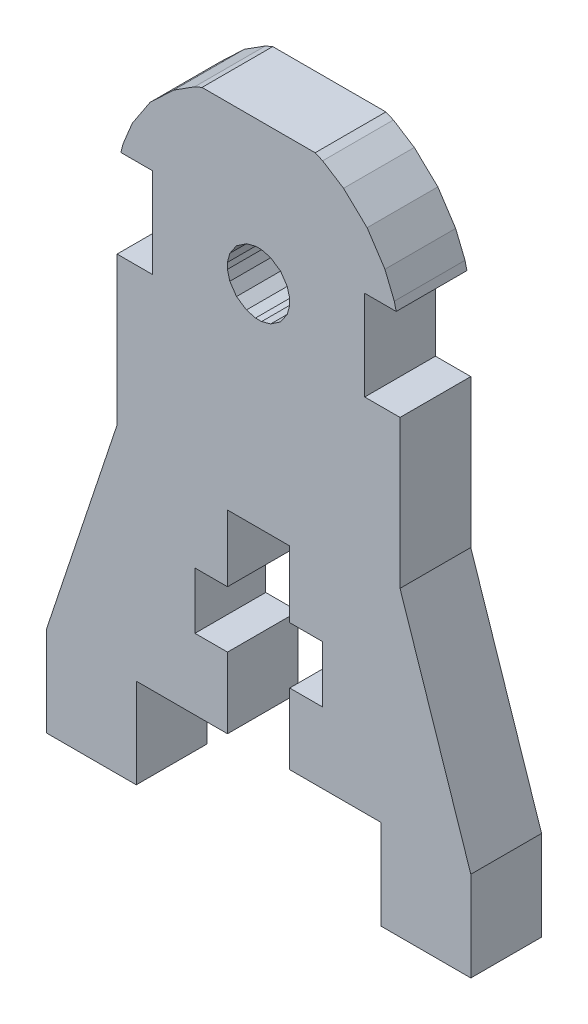
from build123d import *

# Parameters (mm, degrees)
BOSS_EXTRUDE1_DEPTH = 5


with BuildPart() as part:
    # Sketch1 → Boss-Extrude1 (new body)
    with BuildSketch(Plane.XY):
        Polygon((-10.211091397, -1.328977692), (-15.204731397, -16.328947692), (-15.204731397, -22.678947692), (-8.854731397, -22.678947692), (-8.854731397, -16.328947692), (-2.405671397, -16.328947692), (-2.405671397, -11.329465692), (-4.706911397, -11.329465692), (-4.706911397, -7.328965692), (-2.405671397, -7.328965692), (-2.405671397, -2.629965692), (1.988528603, -2.629965692), (1.988528603, -7.328965692), (4.292308603, -7.328965692), (4.292308603, -11.329465692), (1.988528603, -11.329465692), (1.988528603, -16.328947692), (8.442668603, -16.328947692), (8.442668603, -22.678947692), (14.792668603, -22.678947692), (14.792668603, -16.328947692), (9.788868603, -1.328977692), (9.788868603, 9.134552308), (7.292048603, 9.134552308), (7.292048603, 15.485060308), (9.517088603, 15.485060308), (9.382468603, 16.046400308), (8.719528603, 17.669460308), (7.459688603, 19.584620308), (5.795988603, 21.164500308), (4.317708603, 22.106840308), (3.789388603, 22.335440308), (-4.209071397, 22.335440308), (-4.737391397, 22.106840308), (-6.215671397, 21.167040308), (-7.881911397, 19.584620308), (-9.141751397, 17.669460308), (-9.804691397, 16.048940308), (-9.939311397, 15.485060308), (-7.709191397, 15.485060308), (-7.709191397, 9.134552308), (-10.211091397, 9.134552308), align=None)
        Polygon((1.988528603, 12.309552308), (1.988528603, 12.524182308), (1.815808603, 13.166548308), (1.343368603, 13.866572308), (0.644868603, 14.337996308), (0.002248603, 14.509954308), (-0.211111397, 14.509954308), (-0.427011397, 14.509954308), (-1.069631397, 14.337996308), (-1.768131397, 13.866572308), (-2.240571397, 13.166548308), (-2.413291397, 12.524182308), (-2.413291397, 12.309552308), (-2.413291397, 12.095684308), (-2.240571397, 11.453572308), (-1.768131397, 10.755072308), (-1.069631397, 10.283648308), (-0.427011397, 10.110166308), (-0.211111397, 10.110166308), (0.002248603, 10.110166308), (0.644868603, 10.283648308), (1.343368603, 10.755072308), (1.815808603, 11.453572308), (1.988528603, 12.095684308), align=None, mode=Mode.SUBTRACT)
    extrude(amount=BOSS_EXTRUDE1_DEPTH)


solid = part.part
